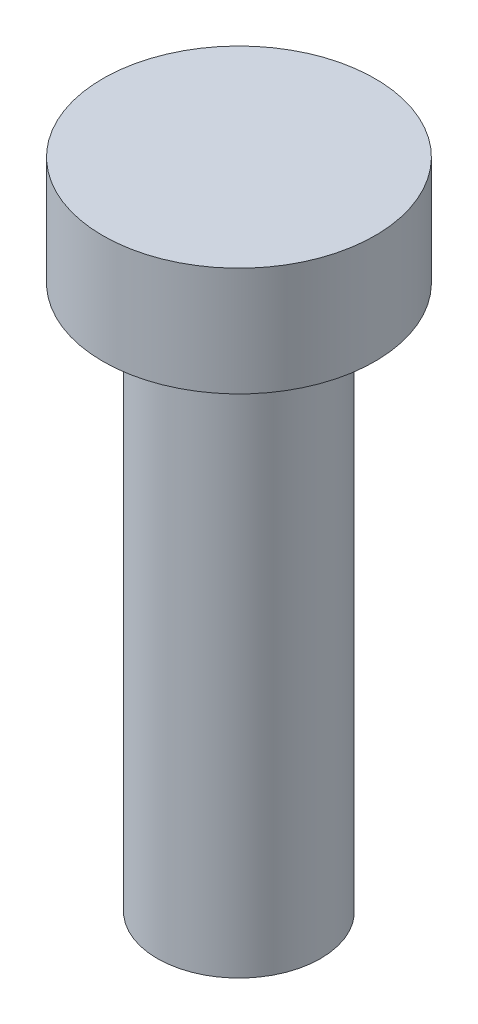
from build123d import *

# Parameters (mm, degrees)
SKETCH1_R           = 2.5
BOSS_EXTRUDE1_DEPTH = 2
SKETCH1_3_R         = 1.5
BOSS_EXTRUDE2_DEPTH = 10


with BuildPart() as part:
    # Sketch1 → Boss-Extrude1 (new body)
    with BuildSketch(Plane(origin=(0, 0, 0), x_dir=(1, 0, 0), z_dir=(0, 1, 0))):
        Circle(SKETCH1_R)
    extrude(amount=BOSS_EXTRUDE1_DEPTH)

    # Sketch1<3> → Boss-Extrude2 (add)
    with BuildSketch(Plane(origin=(0, 0, 0), x_dir=(1, 0, 0), z_dir=(0, 1, 0))):
        Circle(SKETCH1_3_R)
    extrude(amount=-BOSS_EXTRUDE2_DEPTH)


solid = part.part
